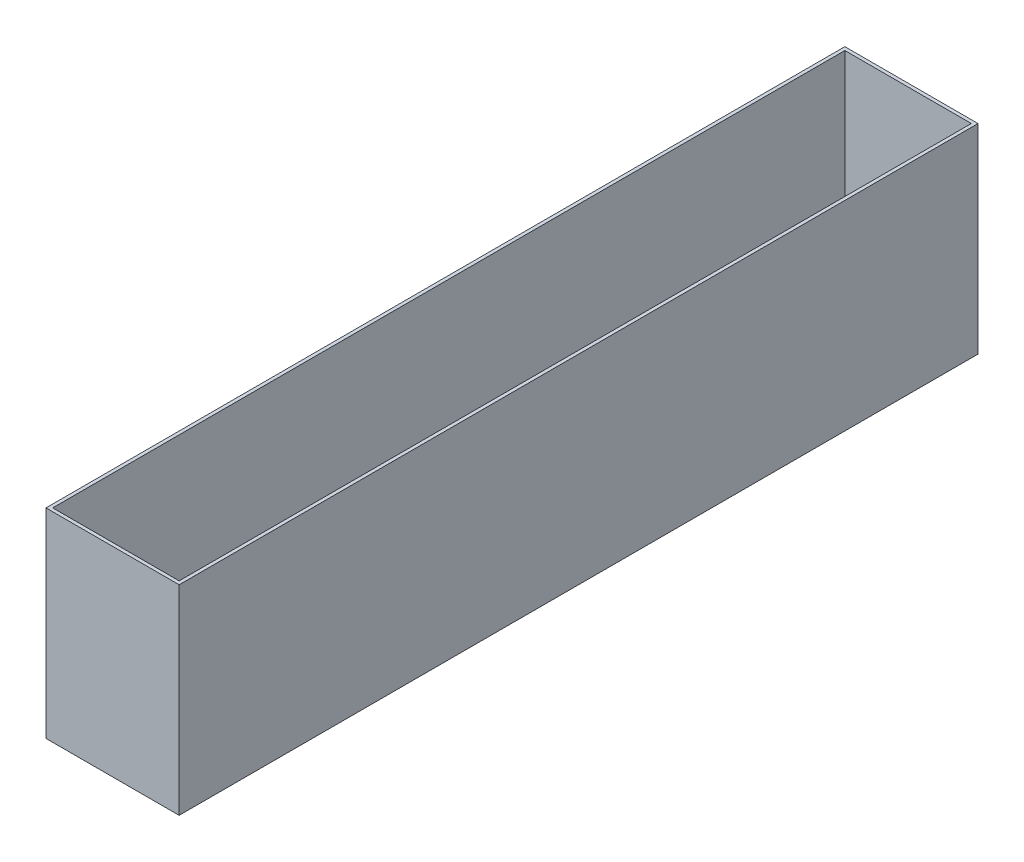
from build123d import *

# Parameters (mm, degrees)
SKETCH1_W           = 200
SKETCH1_H           = 1200
BOSS_EXTRUDE1_DEPTH = 300
SKETCH2_W           = 190
SKETCH2_H           = 1190
CUT_EXTRUDE1_DEPTH  = 290


with BuildPart() as part:
    # Sketch1 → Boss-Extrude1 (new body)
    with BuildSketch(Plane(origin=(0, 0, 0), x_dir=(1, 0, 0), z_dir=(0, 1, 0))):
        with Locations((100, -600)):
            Rectangle(SKETCH1_W, SKETCH1_H)
    extrude(amount=BOSS_EXTRUDE1_DEPTH)

    # Sketch2 → Cut-Extrude1 (cut)
    with BuildSketch(Plane(origin=(0, 300, 0), x_dir=(1, 0, 0), z_dir=(0, 1, 0))):
        with Locations((100, -600)):
            Rectangle(SKETCH2_W, SKETCH2_H)
    extrude(amount=-CUT_EXTRUDE1_DEPTH, mode=Mode.SUBTRACT)


solid = part.part
